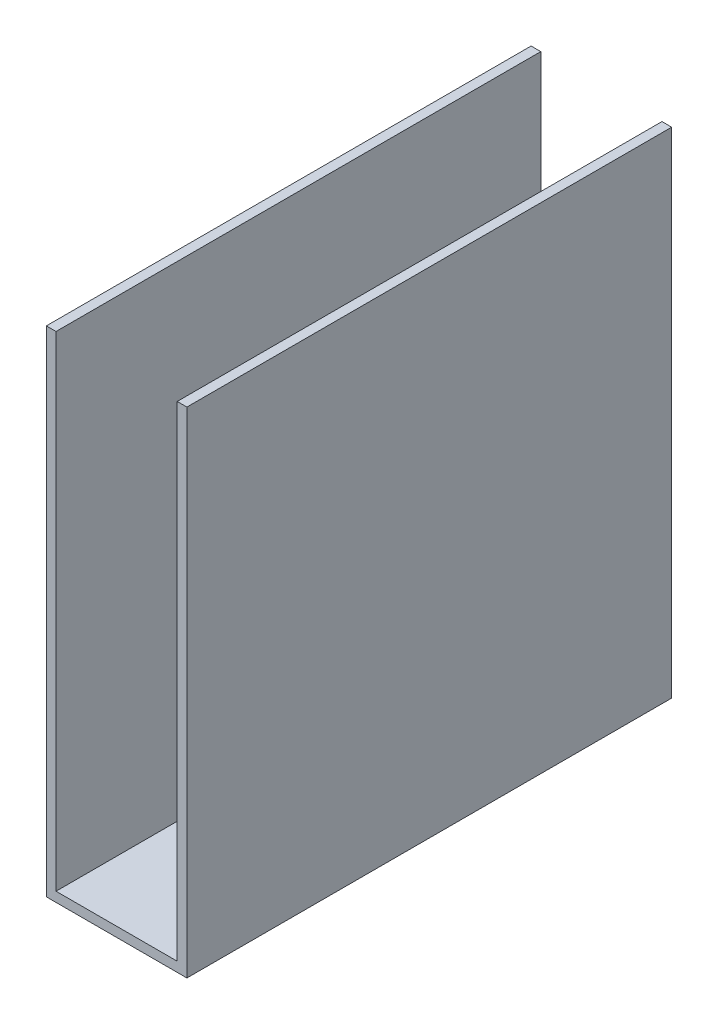
from build123d import *

# Parameters (mm, degrees)
BOSS_EXTRUDE1_DEPTH = 10000


with BuildPart() as part:
    # Sketch2 → Boss-Extrude1 (new body)
    with BuildSketch(Plane.XY):
        Polygon((0, 0), (0, -10000), (2500, -10000), (2500, 0), (2700, 0), (2700, -10200), (-200, -10200), (-200, 0), align=None)
    extrude(amount=-BOSS_EXTRUDE1_DEPTH)


solid = part.part
